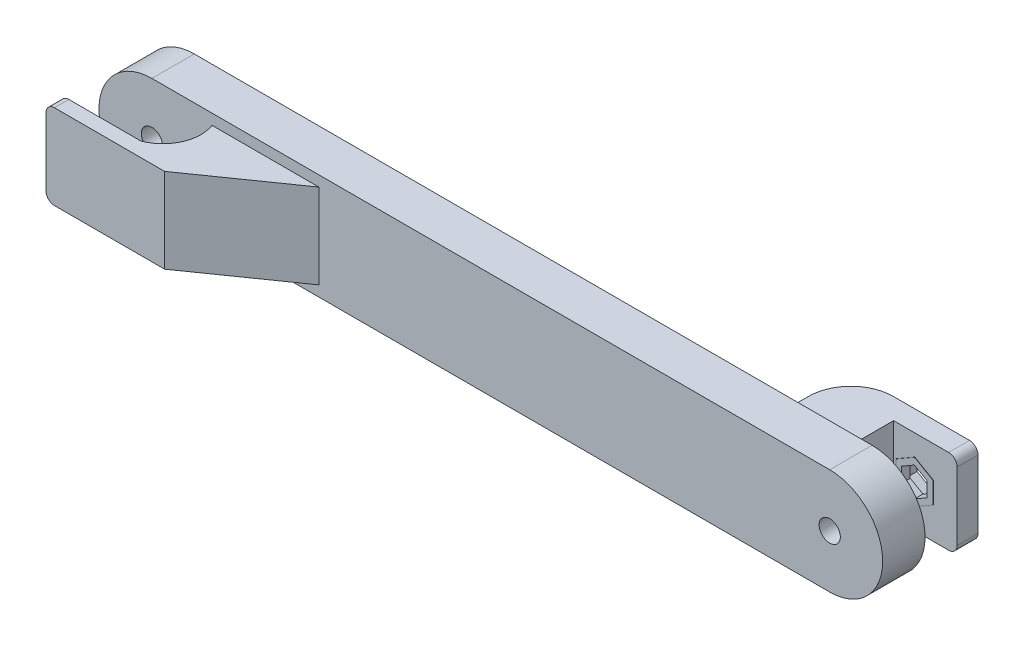
from build123d import *

# Parameters (mm, degrees)
SKETCH1_R            = 3.175
BOSS_EXTRUDE1_DEPTH  = 12.7
BOSS_EXTRUDE8_DEPTH  = 19.05
CUT_EXTRUDE3_DEPTH   = 41.148
BOSS_EXTRUDE9_DEPTH  = 25.4
BOSS_EXTRUDE11_DEPTH = 19.05
SKETCH10_W           = 19.05
SKETCH10_H           = 12.794581221
CUT_EXTRUDE5_DEPTH   = 25.4
BOSS_EXTRUDE12_DEPTH = 2.54
CUT_EXTRUDE6_DEPTH   = 25.4


with BuildPart() as part:
    # Sketch1 → Boss-Extrude1 (new body)
    with BuildSketch(Plane.XY):
        with BuildLine():
            Line((299.870251741, -63.185614448), (503.070251741, -63.185614448))
            ThreePointArc((503.070251741, -63.185614448), (518.945251741, -79.060614448), (503.070251741, -94.935614448))
            Line((503.070251741, -94.935614448), (299.870251741, -94.935614448))
            ThreePointArc((299.870251741, -94.935614448), (283.995251741, -79.060614448), (299.870251741, -63.185614448))
        make_face()
        with Locations((299.870251741, -79.060614448)):
            Circle(SKETCH1_R, mode=Mode.SUBTRACT)
        with Locations((503.070251741, -79.060614448)):
            Circle(SKETCH1_R, mode=Mode.SUBTRACT)
    extrude(amount=BOSS_EXTRUDE1_DEPTH)

    # Sketch7 → Boss-Extrude8 (add)
    with BuildSketch(Plane.XY.offset(12.7)):
        with BuildLine():
            Line((310.030251741, -66.360614448), (312.570251741, -66.360614448))
            Line((312.570251741, -66.360614448), (322.730251741, -66.360614448))
            Line((322.730251741, -66.360614448), (322.730251741, -91.760614448))
            Line((322.730251741, -91.760614448), (310.030251741, -91.760614448))
            Line((310.030251741, -91.760614448), (289.710251741, -91.760614448))
            ThreePointArc((289.710251741, -91.760614448), (287.914200517, -91.016665672), (287.170251741, -89.220614448))
            Line((287.170251741, -89.220614448), (287.170251741, -68.900614448))
            ThreePointArc((287.170251741, -68.900614448), (287.914200517, -67.104563223), (289.710251741, -66.360614448))
            Line((289.710251741, -66.360614448), (310.030251741, -66.360614448))
        make_face()
    extrude(amount=BOSS_EXTRUDE8_DEPTH)

    # Sketch8 → Cut-Extrude3 (cut)
    with BuildSketch(Plane(origin=(0, -66.360614448, 0), x_dir=(1, 0, 0), z_dir=(0, 1, 0))):
        with BuildLine():
            Line((287.170251741, -12.7), (317.904251741, -12.7))
            ThreePointArc((317.904251741, -12.7), (317.648023156, -21.431345807), (311.300251741, -27.432))
            Line((311.300251741, -27.432), (287.170251741, -27.432))
            Line((287.170251741, -27.432), (287.170251741, -12.7))
        make_face()
    extrude(amount=-CUT_EXTRUDE3_DEPTH, mode=Mode.SUBTRACT)

    # Sketch9 → Boss-Extrude9 (add)
    with BuildSketch(Plane(origin=(0, -66.360614448, 0), x_dir=(1, 0, 0), z_dir=(0, 1, 0))):
        Polygon((322.730251741, -31.75), (349.936471269, -12.7), (322.730251741, -12.7), align=None)
    extrude(amount=-BOSS_EXTRUDE9_DEPTH)

    # Sketch2 → Boss-Extrude11 (add)
    with BuildSketch(Plane(origin=(0, 0, 0), x_dir=(-1, 0, 0), z_dir=(0, 0, -1))):
        with BuildLine():
            Line((-477.670251741, -66.360614448), (-477.670251741, -91.760614448))
            Line((-477.670251741, -91.760614448), (-513.230251741, -91.760614448))
            ThreePointArc((-513.230251741, -91.760614448), (-515.026302965, -91.016665672), (-515.770251741, -89.220614448))
            Line((-515.770251741, -89.220614448), (-515.770251741, -68.900614448))
            ThreePointArc((-515.770251741, -68.900614448), (-515.026302965, -67.104563223), (-513.230251741, -66.360614448))
            Line((-513.230251741, -66.360614448), (-477.670251741, -66.360614448))
        make_face()
        Polygon((-503.070251741, -72.644809581), (-508.626501741, -75.852712014), (-508.626501741, -82.268516881), (-503.070251741, -85.476419314), (-497.514001741, -82.268516881), (-497.514001741, -75.852712014), align=None, mode=Mode.SUBTRACT)
    extrude(amount=BOSS_EXTRUDE11_DEPTH)

    # Sketch10 → Cut-Extrude5 (cut)
    with BuildSketch(Plane.XZ.offset(91.760614448)):
        with Locations((506.245251741, -6.397290611)):
            Rectangle(SKETCH10_W, SKETCH10_H)
    extrude(amount=-CUT_EXTRUDE5_DEPTH, mode=Mode.SUBTRACT)

    # Sketch11 → Boss-Extrude12 (add)
    with BuildSketch(Plane(origin=(0, 0, -12.7), x_dir=(-1, 0, 0), z_dir=(0, 0, -1))):
        Polygon((-503.070251741, -72.644809581), (-508.626501741, -75.852712014), (-508.626501741, -82.268516881), (-503.070251741, -85.476419314), (-497.514001741, -82.268516881), (-497.514001741, -75.852712014), align=None)
        Polygon((-503.070251741, -74.661205396), (-506.880251741, -76.860909922), (-506.880251741, -81.260318973), (-503.070251741, -83.460023499), (-499.260251741, -81.260318973), (-499.260251741, -76.860909922), align=None, mode=Mode.SUBTRACT)
    extrude(amount=BOSS_EXTRUDE12_DEPTH)

    # Sketch12 → Cut-Extrude6 (cut)
    with BuildSketch(Plane(origin=(0, -66.360614448, 0), x_dir=(1, 0, 0), z_dir=(0, 1, 0))):
        with BuildLine():
            Line((477.670251741, 6.35), (477.670251741, 9.525))
            Line((477.670251741, 9.525), (477.670251741, 19.05))
            Line((477.670251741, 19.05), (486.490339075, 19.05))
            Line((486.490339075, 19.05), (490.370251741, 19.05))
            ThreePointArc((490.370251741, 19.05), (481.38999562, 15.330256121), (477.670251741, 6.35))
        make_face()
    extrude(amount=-CUT_EXTRUDE6_DEPTH, mode=Mode.SUBTRACT)


solid = part.part
